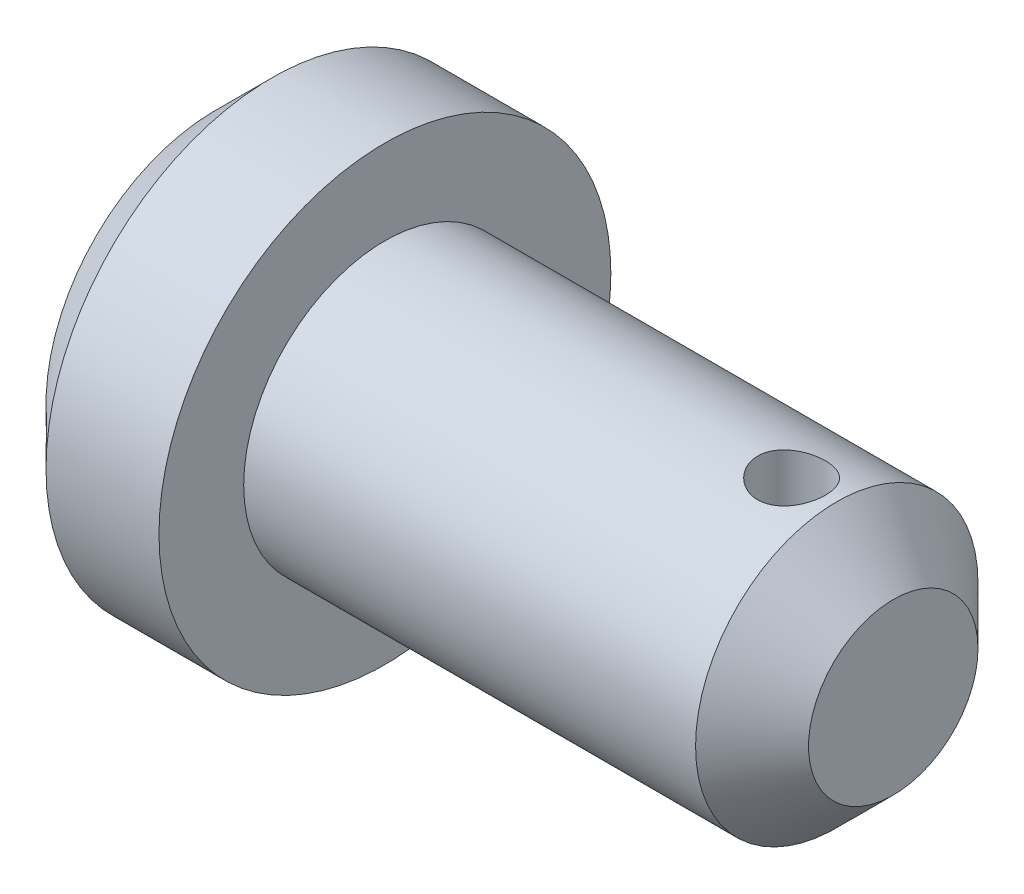
from build123d import *

# Parameters (mm, degrees)
SKETCH1_R           = 40
BOSS_EXTRUDE1_DEPTH = 30
CHAMFER1_SIZE       = 10
SKETCH2_R           = 25
BOSS_EXTRUDE2_DEPTH = 90
CHAMFER2_SIZE       = 10
SKETCH3_R           = 6
CUT_EXTRUDE1_DEPTH  = 90


with BuildPart() as part:
    # Sketch1 → Boss-Extrude1 (new body)
    with BuildSketch(Plane(origin=(0, 0, 0), x_dir=(0, 0, -1), z_dir=(1, 0, 0))):
        Circle(SKETCH1_R)
    extrude(amount=BOSS_EXTRUDE1_DEPTH)

    # Chamfer1
    chamfer1_edges = [part.edges().sort_by_distance(p)[0] for p in [
        (0, 0, 40),
    ]]
    chamfer(chamfer1_edges, length=CHAMFER1_SIZE)

    # Sketch2 → Boss-Extrude2 (add)
    with BuildSketch(Plane(origin=(30, 0, 0), x_dir=(0, 0, -1), z_dir=(1, 0, 0))):
        with Locations(Location((0, 0, 0), (0, 0, 180))):
            Circle(SKETCH2_R)
    extrude(amount=BOSS_EXTRUDE2_DEPTH)

    # Chamfer2
    chamfer2_edges = [part.edges().sort_by_distance(p)[0] for p in [
        (120, 0, -25),
    ]]
    chamfer(chamfer2_edges, length=CHAMFER2_SIZE)

    # Sketch3 → Cut-Extrude1 (cut)
    with BuildSketch(Plane(origin=(0, 25, 0), x_dir=(1, 0, 0), z_dir=(0, 1, 0))):
        with Locations(Location((102, 0, 0), (0, 0, 270))):
            Circle(SKETCH3_R)
    extrude(amount=-CUT_EXTRUDE1_DEPTH, mode=Mode.SUBTRACT)


solid = part.part
